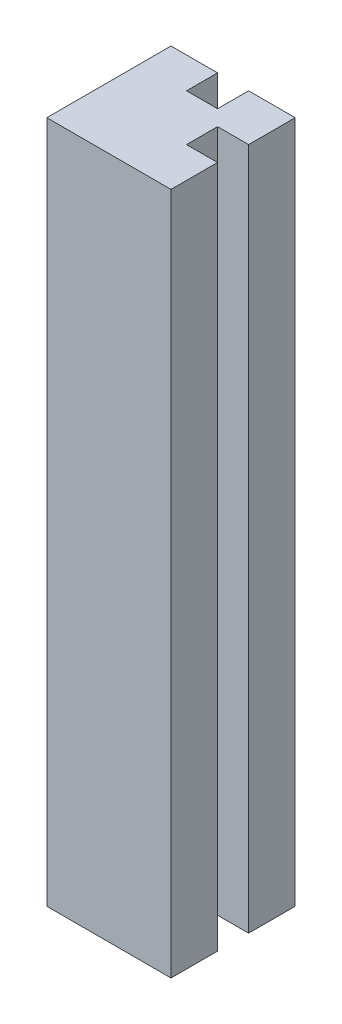
from build123d import *

# Parameters (mm, degrees)
SKIZZE1_W                       = 20
SKIZZE1_H                       = 20
AUFSATZ_LINEAR_AUSTRAGEN1_DEPTH = 110
SKIZZE2_W                       = 5
SKIZZE2_H                       = 10
SKIZZE2_W_2                     = 10
SKIZZE2_H_2                     = 5
SCHNITT_LINEAR_AUSTRAGEN1_DEPTH = 111.905365064


with BuildPart() as part:
    # Skizze1 → Aufsatz-Linear austragen1 (new body)
    with BuildSketch(Plane(origin=(0, 0, 0), x_dir=(1, 0, 0), z_dir=(0, 1, 0))):
        Rectangle(SKIZZE1_W, SKIZZE1_H)
    extrude(amount=AUFSATZ_LINEAR_AUSTRAGEN1_DEPTH)

    # Skizze2 → Schnitt-Linear austragen1 (cut, through all)
    with BuildSketch(Plane(origin=(0, 110, 0), x_dir=(1, 0, 0), z_dir=(0, 1, 0))):
        with Locations((0, 10)):
            Rectangle(SKIZZE2_W, SKIZZE2_H)
        with Locations((10, 0)):
            Rectangle(SKIZZE2_W_2, SKIZZE2_H_2)
    extrude(amount=-SCHNITT_LINEAR_AUSTRAGEN1_DEPTH, mode=Mode.SUBTRACT)


solid = part.part
